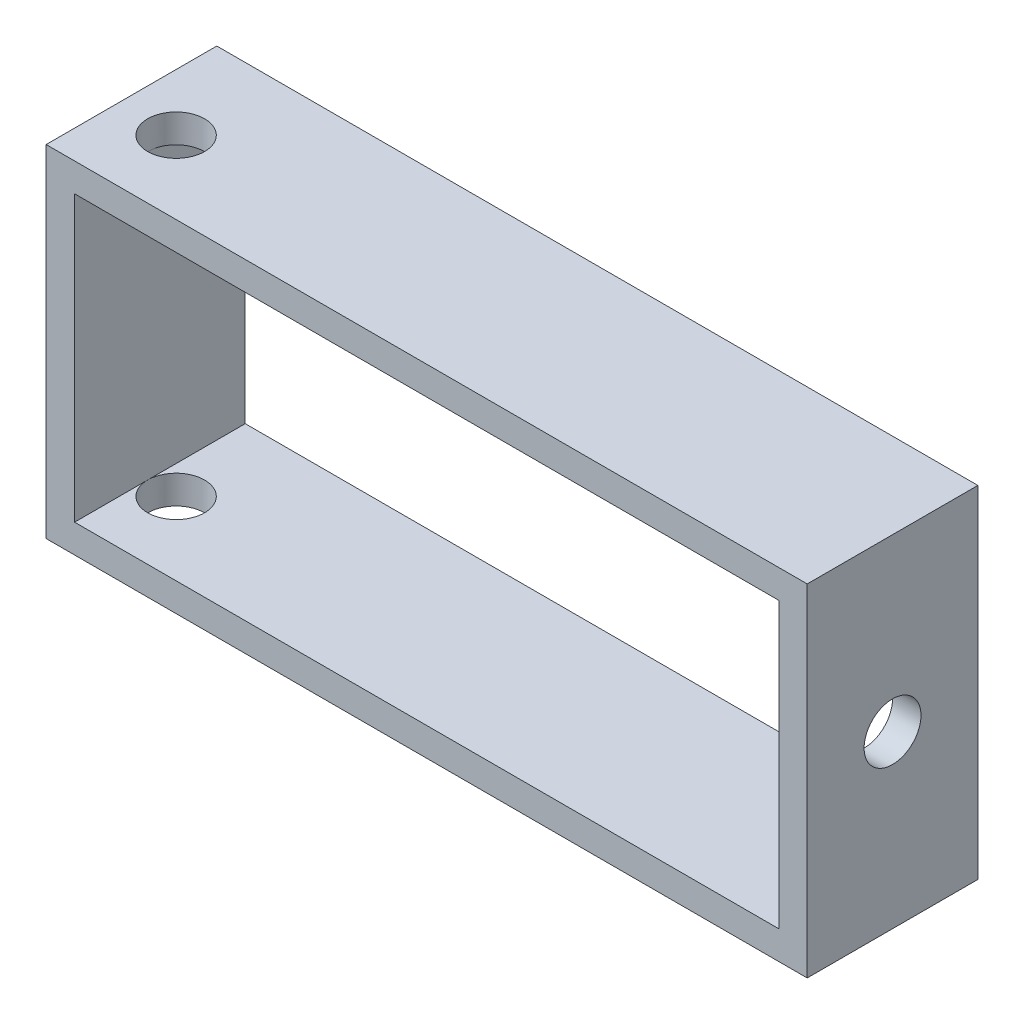
from build123d import *

# Parameters (mm, degrees)
CROQUIS1_W              = 133.8
CROQUIS1_H              = 30
CROQUIS1_R              = 5
SALIENTE_EXTRUIR1_DEPTH = 60
CROQUIS2_W              = 123.8
CROQUIS2_H              = 50
CORTAR_EXTRUIR1_DEPTH   = 119.130169906
CROQUIS3_R              = 5
CORTAR_EXTRUIR2_DEPTH   = 10


with BuildPart() as part:
    # Croquis1 → Saliente-Extruir1 (new body)
    with BuildSketch(Plane(origin=(0, 0, 0), x_dir=(1, 0, 0), z_dir=(0, 1, 0))):
        with Locations((30.335472139, 9.642857143)):
            Rectangle(CROQUIS1_W, CROQUIS1_H)
        with Locations((-26.564527861, 7.494831092)):
            Circle(CROQUIS1_R, mode=Mode.SUBTRACT)
    extrude(amount=SALIENTE_EXTRUIR1_DEPTH)

    # Croquis2 → Cortar-Extruir1 (cut, through all)
    with BuildSketch(Plane.XY.offset(5.357142857)):
        with Locations((30.335472139, 30)):
            Rectangle(CROQUIS2_W, CROQUIS2_H)
    extrude(amount=-CORTAR_EXTRUIR1_DEPTH, mode=Mode.SUBTRACT)

    # Croquis3 → Cortar-Extruir2 (cut)
    with BuildSketch(Plane(origin=(97.235472139, 0, 0), x_dir=(0, 0, -1), z_dir=(1, 0, 0))):
        with Locations((9.642857143, 30)):
            Circle(CROQUIS3_R)
    extrude(amount=-CORTAR_EXTRUIR2_DEPTH, mode=Mode.SUBTRACT)


solid = part.part
